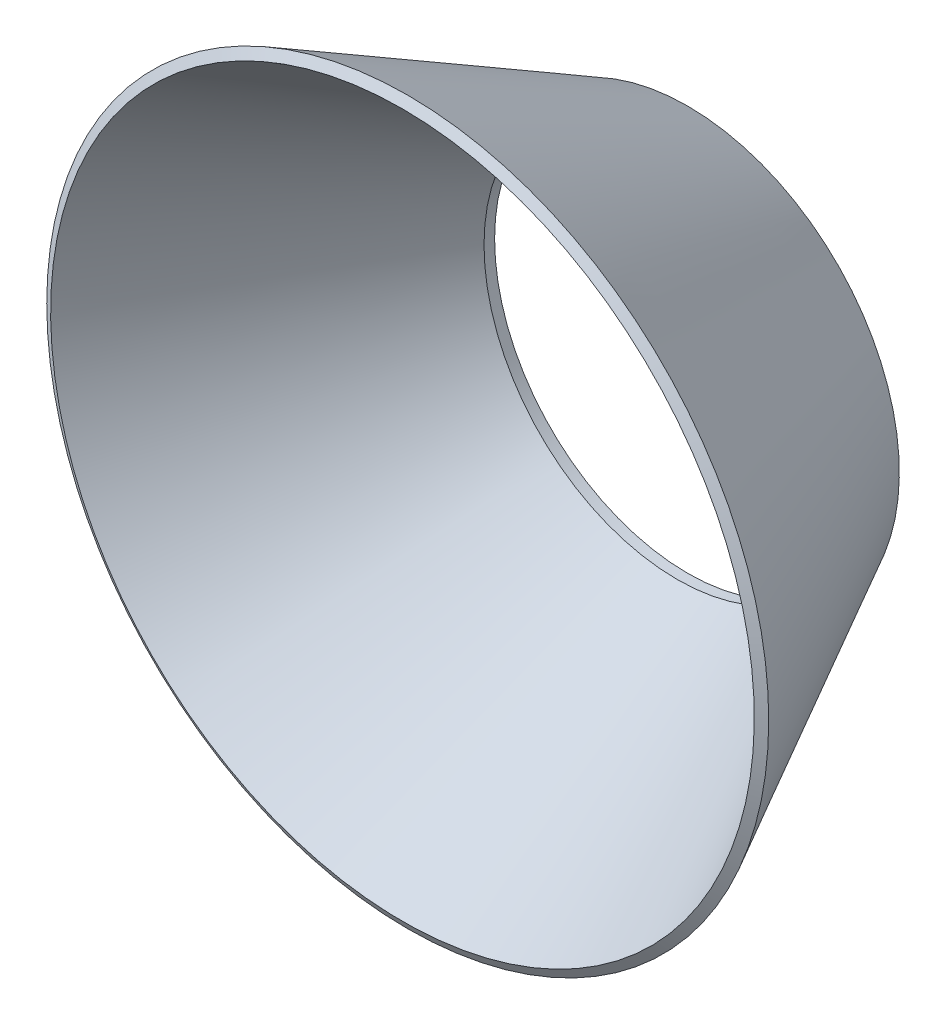
from build123d import *

# Parameters (mm, degrees)
SKETCH_1_R          = 100
SKETCH_1_R_2        = 95
EXTRUDE_1_DEPTH     = 70
EXTRUDE_START       = 5
SKETCH_2_R          = 100
EXTRUDE_2_DEPTH     = 5
SKETCH_6_R          = 100
CUT_EXTRUDE_1_DEPTH = 75
EXTRUDE_3_REACH     = 223.205
SKETCH_8_R          = 80
SKETCH_8_R_2        = 73.07179677


with BuildPart() as part:
    # 草图1 → 凸台-拉伸1 (new body)
    with BuildSketch(Plane.XY):
        Circle(SKETCH_1_R)
        Circle(SKETCH_1_R_2, mode=Mode.SUBTRACT)
    extrude(amount=EXTRUDE_1_DEPTH)

    # 草图2 → 凸台-拉伸2 (add)
    with BuildSketch(Plane(origin=(0, 0, 0), x_dir=(-1, 0, 0), z_dir=(0, 0, -1)).offset(EXTRUDE_START)):
        Circle(SKETCH_2_R)
    extrude(amount=-EXTRUDE_2_DEPTH)

    # 草图6 → 切除-拉伸1 (cut)
    with BuildSketch(Plane(origin=(0, 0, -5), x_dir=(-1, 0, 0), z_dir=(0, 0, -1))):
        Circle(SKETCH_6_R)
    extrude(amount=-CUT_EXTRUDE_1_DEPTH, mode=Mode.SUBTRACT)


with BuildPart() as body_2:
    # 草图5 → 旋转1 (revolve)
    with BuildSketch(Plane(origin=(0, 0, 0), x_dir=(0, 0, -1), z_dir=(1, 0, 0))):
        Polygon((-75.339745962, 73.07179677), (-71.339745962, 80), (-177.262794416, 136.535898385), (-179.262794416, 133.07179677), align=None)
    revolve(axis=Axis((0, 0, 0), (0, 0, 1)))

    # 凸台-拉伸3: up to this cone (the profile starts outside it)
    extrude_3_end = Plane(origin=(0, 0, 71.339746), z_dir=(0, 0, 1)).offset(-122.564063643) * Cone(1e-06, 240.773225898, 417.031459358, align=(Align.CENTER, Align.CENTER, Align.MIN), mode=Mode.PRIVATE)
    # 草图8 → 凸台-拉伸3 (add, up to the surface)
    with BuildSketch(Plane(origin=(0, 0, 71.339745962), x_dir=(-1, 0, 0), z_dir=(0, 0, -1)), mode=Mode.PRIVATE) as extrude_3_sk1:
        Circle(SKETCH_8_R)
        with Locations(Location((0, 0, 0), (0, 0, 90))):
            Circle(SKETCH_8_R_2, mode=Mode.SUBTRACT)
    extrude_3_tool1 = extrude(extrude_3_sk1.sketch, amount=-EXTRUDE_3_REACH, mode=Mode.PRIVATE) - extrude_3_end
    add(extrude_3_tool1.solids().sort_by_distance((77.737258, 0, 71.339746))[0])


solid = body_2.part
